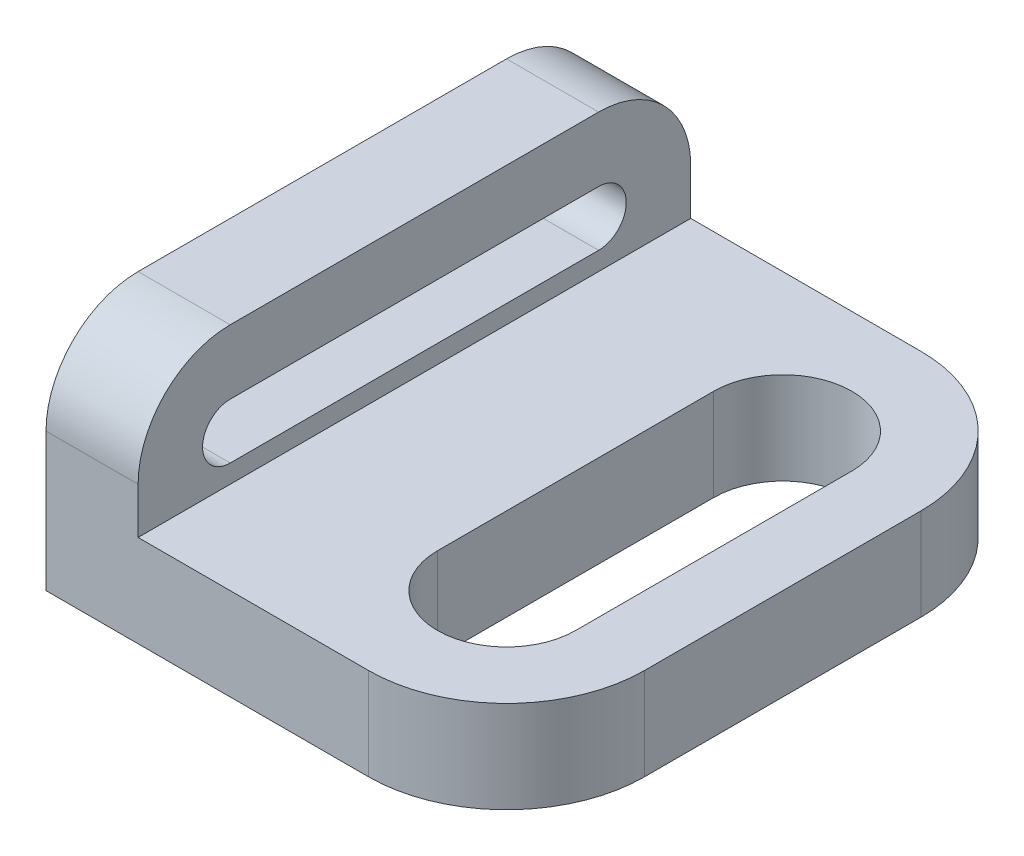
from build123d import *

# Parameters (mm, degrees)
BOSS_EXTRUDE1_DEPTH = 20
BOSS_EXTRUDE2_DEPTH = 20


with BuildPart() as part:
    # Sketch1 → Boss-Extrude1 (new body)
    with BuildSketch(Plane(origin=(0, 0, 0), x_dir=(1, 0, 0), z_dir=(0, 1, 0))):
        with BuildLine():
            ThreePointArc((20, 60), (41.213203436, 51.213203436), (50, 30))
            Line((50, 30), (50, -30))
            ThreePointArc((50, -30), (41.213203436, -51.213203436), (20, -60))
            Line((20, -60), (-50, -60))
            Line((-50, -60), (-50, 60))
            Line((-50, 60), (20, 60))
        make_face()
        with BuildLine():
            Line((35, -30), (35, 30))
            ThreePointArc((35, 30), (20, 45), (5, 30))
            Line((5, 30), (5, -30))
            ThreePointArc((5, -30), (20, -45), (35, -30))
        make_face(mode=Mode.SUBTRACT)
    extrude(amount=BOSS_EXTRUDE1_DEPTH)

    # Sketch3 → Boss-Extrude2 (add)
    with BuildSketch(Plane(origin=(-50, 0, 0), x_dir=(0, 0, -1), z_dir=(1, 0, 0))):
        with BuildLine():
            Line((40, 50), (-40, 50))
            ThreePointArc((-40, 50), (-54.142135624, 44.142135624), (-60, 30))
            Line((-60, 30), (-60, 20))
            Line((-60, 20), (60, 20))
            Line((60, 20), (60, 30))
            ThreePointArc((60, 30), (54.142135624, 44.142135624), (40, 50))
        make_face()
        with BuildLine():
            Line((40, 36), (-40, 36))
            ThreePointArc((-40, 36), (-46, 30), (-40, 24))
            Line((-40, 24), (40, 24))
            ThreePointArc((40, 24), (46, 30), (40, 36))
        make_face(mode=Mode.SUBTRACT)
    extrude(amount=BOSS_EXTRUDE2_DEPTH)


solid = part.part
